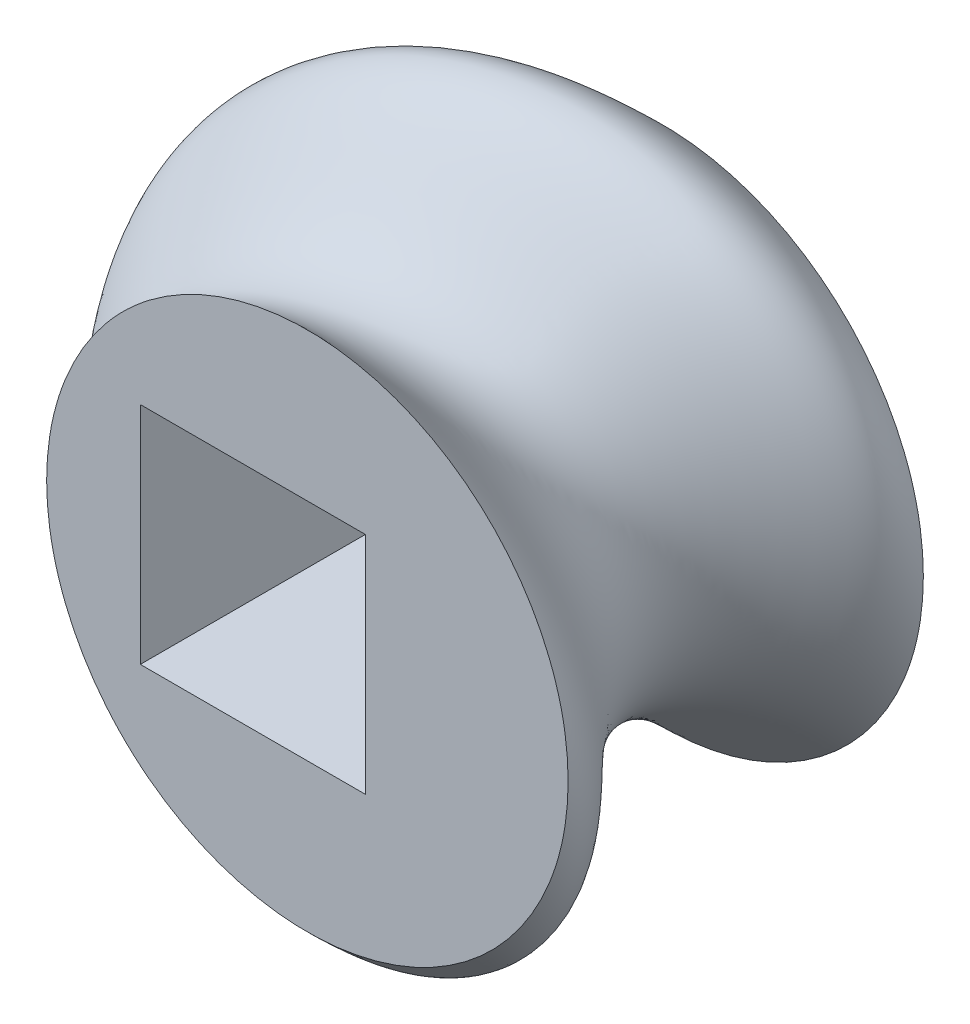
from build123d import *

# Parameters (mm, degrees)
AUSTRAGUNG1_PITCH               = 20
AUSTRAGUNG1_HEIGHT              = 20
AUSTRAGUNG1_RADIUS              = 4
SKIZZE2_R                       = 14.681
SKIZZE3_2_R                     = 4
SCHNITT_LINEAR_AUSTRAGEN2_DEPTH = 27
SKIZZE8_W                       = 12.67071878
SKIZZE8_H                       = 12.67071878
SCHNITT_LINEAR_AUSTRAGEN3_DEPTH = 25


with BuildPart() as part:
    # Austragung1: sweep along a helix
    with BuildLine() as austragung1_path:
        Helix(AUSTRAGUNG1_PITCH, AUSTRAGUNG1_HEIGHT, AUSTRAGUNG1_RADIUS, center=(-3.071, 0, 0), direction=(0, 0, 1))
    # Skizze2 → Austragung1 (sweep)
    with BuildSketch(Plane.XY):
        Circle(SKIZZE2_R)
    sweep(path=austragung1_path.line, is_frenet=True)

    # Skizze3<2> → Schnitt-Linear austragen2 (cut)
    with BuildSketch(Plane.XY):
        with Locations(Location((-3.071, 0, 0), (0, 0, 180))):
            Circle(SKIZZE3_2_R)
    extrude(amount=SCHNITT_LINEAR_AUSTRAGEN2_DEPTH, mode=Mode.SUBTRACT)

    # Skizze8 → Schnitt-Linear austragen3 (cut)
    with BuildSketch(Plane.XY.offset(20)):
        with Locations((-3.071, 0)):
            Rectangle(SKIZZE8_W, SKIZZE8_H)
    extrude(amount=-SCHNITT_LINEAR_AUSTRAGEN3_DEPTH, mode=Mode.SUBTRACT)


solid = part.part
